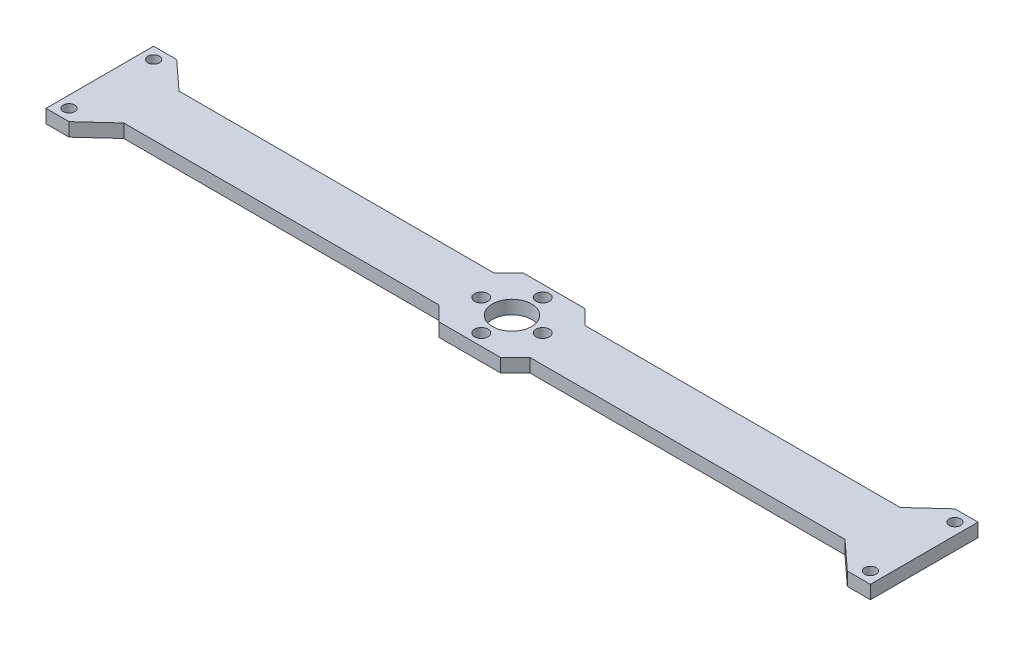
from build123d import *

# Parameters (mm, degrees)
SKETCH1_R           = 1.75
SKETCH1_R_2         = 5.1
SKETCH1_R_3         = 1.5
BOSS_EXTRUDE1_DEPTH = 3.5


with BuildPart() as part:
    # Sketch1 → Boss-Extrude1 (new body)
    with BuildSketch(Plane(origin=(0, 0, 0), x_dir=(1, 0, 0), z_dir=(0, 1, 0))):
        Polygon((-93.819210637, 7.180789363), (-11.819210637, 7.180789363), (-8, 11), (8, 11), (11.819210637, 7.180789363), (93.819210637, 7.180789363), (101.25, 14), (107.25, 14), (107.25, -14), (101.25, -14), (93.819210637, -7.180789363), (11.819210637, -7.180789363), (8, -11), (-8, -11), (-11.819210637, -7.180789363), (-93.819210637, -7.180789363), (-101.25, -14), (-107.25, -14), (-107.25, 14), (-101.25, 14), align=None)
        with Locations(Location((-8, 0, 0), (0, 0, 270))):
            Circle(SKETCH1_R, mode=Mode.SUBTRACT)
        with Locations(Location((8, 0, 0), (0, 0, 270))):
            Circle(SKETCH1_R, mode=Mode.SUBTRACT)
        with Locations(Location((0, 0, 0), (0, 0, 270))):
            Circle(SKETCH1_R_2, mode=Mode.SUBTRACT)
        with Locations(Location((-104.25, -11, 0), (0, 0, 90))):
            Circle(SKETCH1_R_3, mode=Mode.SUBTRACT)
        with Locations(Location((0, 8, 0), (0, 0, 270))):
            Circle(SKETCH1_R, mode=Mode.SUBTRACT)
        with Locations(Location((0, -8, 0), (0, 0, 90))):
            Circle(SKETCH1_R, mode=Mode.SUBTRACT)
        with Locations(Location((-104.25, 11, 0), (0, 0, 270))):
            Circle(SKETCH1_R_3, mode=Mode.SUBTRACT)
        with Locations(Location((104.25, 11, 0), (0, 0, 270))):
            Circle(SKETCH1_R_3, mode=Mode.SUBTRACT)
        with Locations(Location((104.25, -11, 0), (0, 0, 270))):
            Circle(SKETCH1_R_3, mode=Mode.SUBTRACT)
    extrude(amount=BOSS_EXTRUDE1_DEPTH)


solid = part.part
